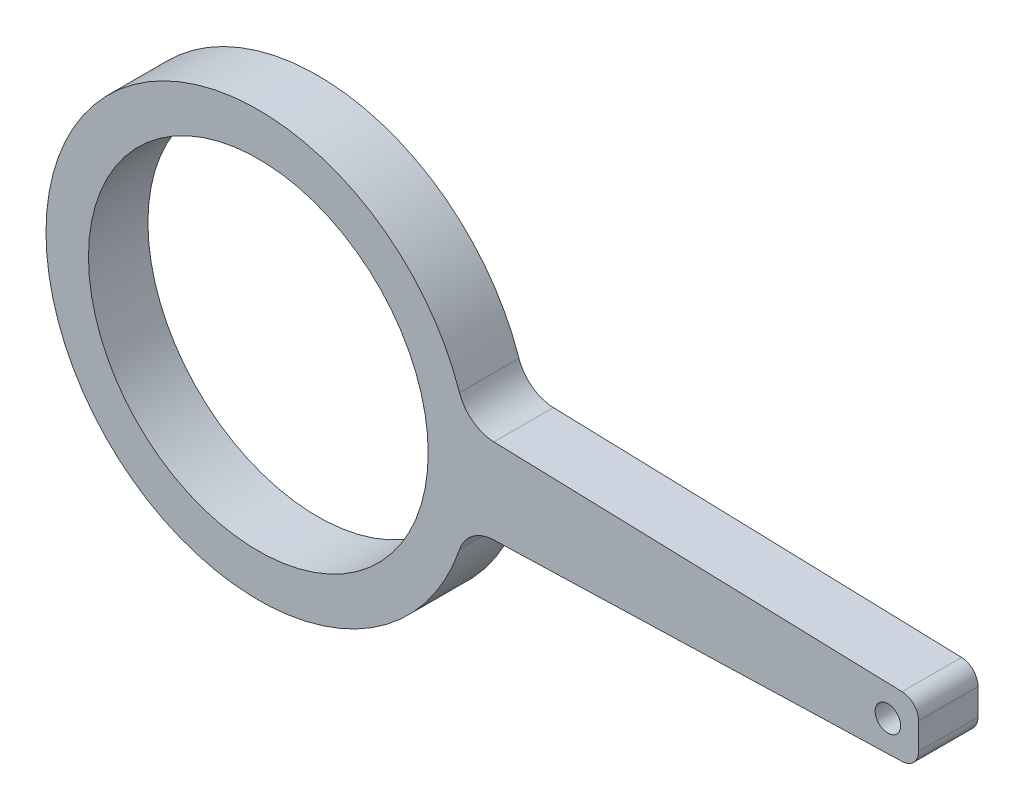
from build123d import *

# Parameters (mm, degrees)
SKETCH1_R           = 20
SKETCH1_R_2         = 1.5
BOSS_EXTRUDE1_DEPTH = 7


with BuildPart() as part:
    # Sketch1 → Boss-Extrude1 (new body)
    with BuildSketch(Plane.XY):
        with BuildLine():
            Line((77.735606869, -1.559100202), (77.735606869, 1.559100202))
            ThreePointArc((77.735606869, 1.559100202), (77.170867479, 2.951948716), (75.795579887, 3.558200809))
            Line((75.795579887, 3.558200809), (27.735606869, 5))
            ThreePointArc((27.735606869, 5), (25.240316673, 5.865195462), (23.685438565, 8))
            ThreePointArc((23.685438565, 8), (-25, 0), (23.685438565, -8))
            ThreePointArc((23.685438565, -8), (25.240316673, -5.865195462), (27.735606869, -5))
            Line((27.735606869, -5), (75.795579887, -3.558200809))
            ThreePointArc((75.795579887, -3.558200809), (77.170867479, -2.951948716), (77.735606869, -1.559100202))
        make_face()
        Circle(SKETCH1_R, mode=Mode.SUBTRACT)
        with Locations((74.127359446, 0)):
            Circle(SKETCH1_R_2, mode=Mode.SUBTRACT)
    extrude(amount=BOSS_EXTRUDE1_DEPTH)


solid = part.part
